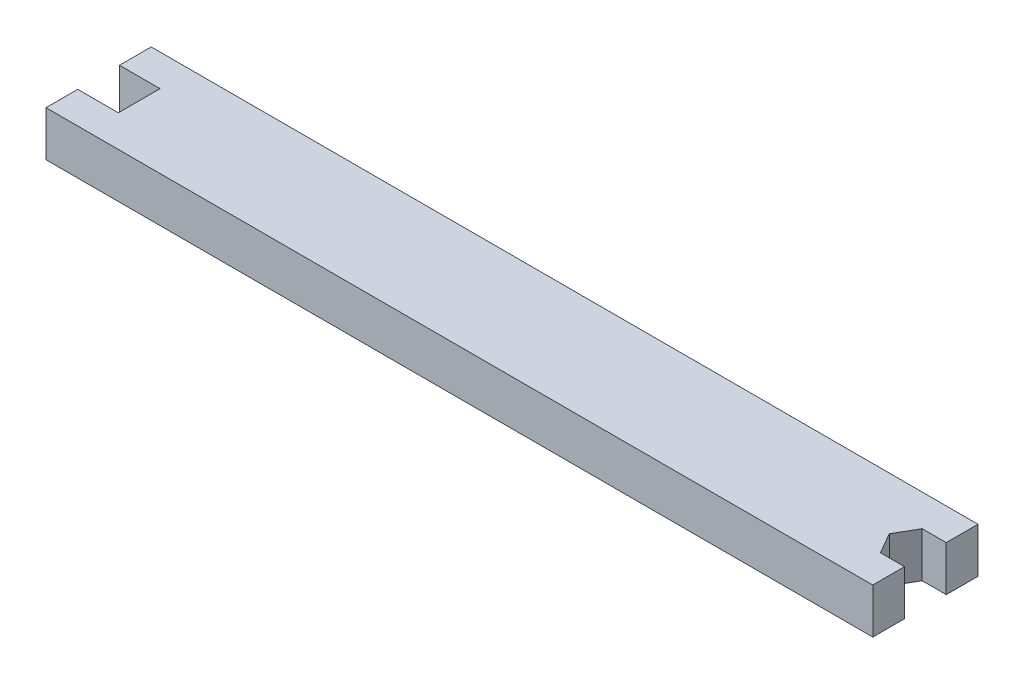
from build123d import *

# Parameters (mm, degrees)
SZKIC1_W                    = 110
SZKIC1_H                    = 14
DODANIE_WYCI_GNI_CIE1_DEPTH = 6
SZKIC2_W                    = 5.4
SZKIC2_H                    = 5.55
WYTNIJ_WYCI_GNI_CIE1_DEPTH  = 6
WYTNIJ_WYCI_GNI_CIE2_DEPTH  = 6


with BuildPart() as part:
    # Szkic1 → Dodanie-wyciągnięcie1 (new body)
    with BuildSketch(Plane(origin=(0, 0, 0), x_dir=(1, 0, 0), z_dir=(0, 1, 0))):
        with Locations((55, -89.241330813)):
            Rectangle(SZKIC1_W, SZKIC1_H)
    extrude(amount=DODANIE_WYCI_GNI_CIE1_DEPTH)

    # Szkic2 → Wytnij-wyciągnięcie1 (cut)
    with BuildSketch(Plane(origin=(0, 6, 0), x_dir=(1, 0, 0), z_dir=(0, 1, 0))):
        with Locations((2.7, -89.241330813)):
            Rectangle(SZKIC2_W, SZKIC2_H)
    extrude(amount=-WYTNIJ_WYCI_GNI_CIE1_DEPTH, mode=Mode.SUBTRACT)

    # Szkic3 → Wytnij-wyciągnięcie2 (cut)
    with BuildSketch(Plane(origin=(0, 6, 0), x_dir=(1, 0, 0), z_dir=(0, 1, 0))):
        Polygon((106.795706006, -92.016330813), (110, -92.016330813), (111.602146997, -89.241330813), (110, -86.466330813), (106.795706006, -86.466330813), (105.193559009, -89.241330813), align=None)
    extrude(amount=-WYTNIJ_WYCI_GNI_CIE2_DEPTH, mode=Mode.SUBTRACT)


solid = part.part
